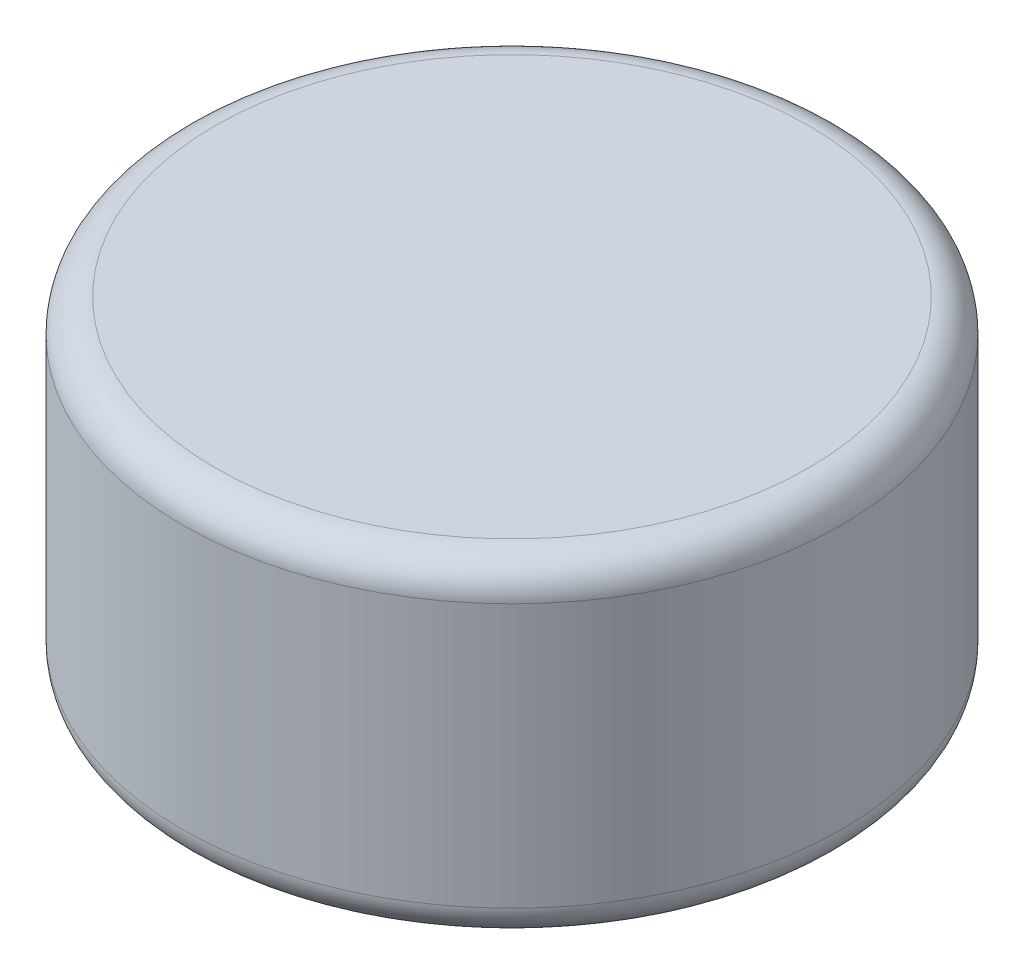
from build123d import *

# Parameters (mm, degrees)
SKETCH1_R           = 3.175
BOSS_EXTRUDE1_DEPTH = 1.5875
FILLET1_R           = 0.3175


with BuildPart() as part:
    # Sketch1 → Boss-Extrude1 (new, symmetric)
    with BuildSketch(Plane(origin=(0, 0, 0), x_dir=(1, 0, 0), z_dir=(0, 1, 0))):
        with Locations(Location((0, 0, 0), (0, 0, 270))):
            Circle(SKETCH1_R)
    extrude(amount=BOSS_EXTRUDE1_DEPTH, both=True)

    # Fillet1
    fillet1_edges = [part.edges().sort_by_distance(p)[0] for p in [
        (0, -1.5875, -3.175),
        (0, 1.5875, -3.175),
    ]]
    fillet(fillet1_edges, radius=FILLET1_R)


solid = part.part
